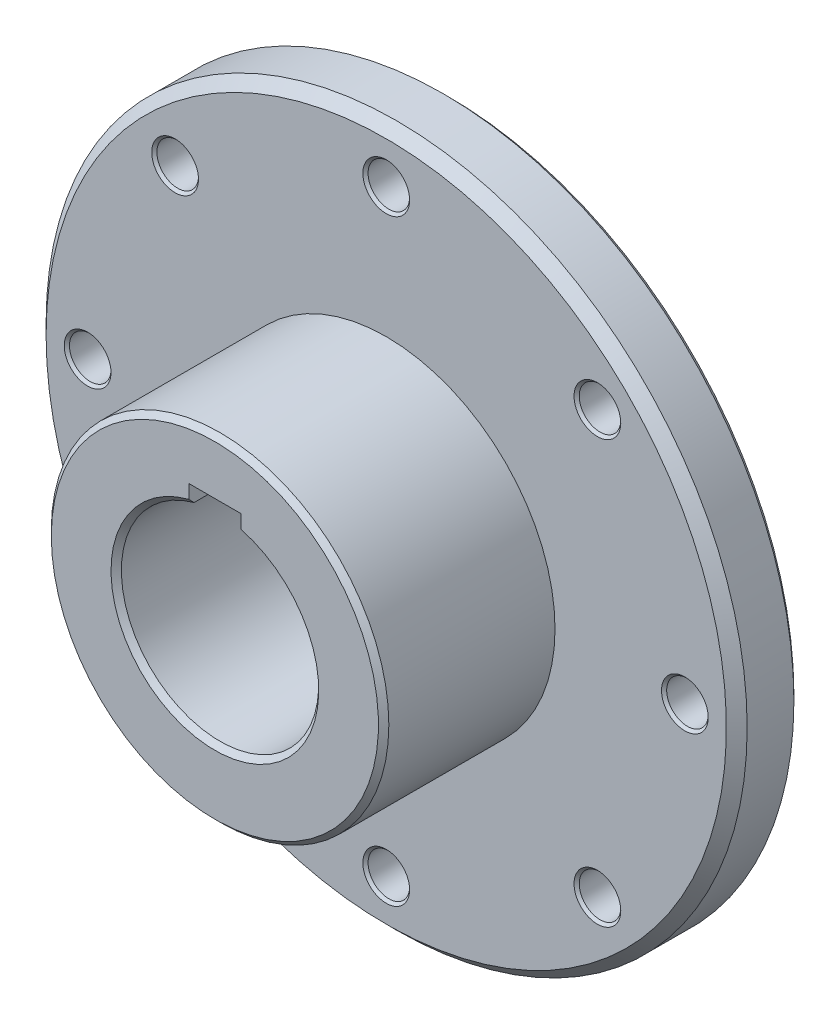
from build123d import *

# Parameters (mm, degrees)
SKETCH_1_R          = 32.5
EXTRUDE_1_DEPTH     = 10
SKETCH_2_R          = 67.5
EXTRUDE_2_DEPTH     = 12
SKETCH_3_R          = 19
CUT_EXTRUDE_1_DEPTH = 45
SKETCH_4_R          = 32.5
SKETCH_4_R_2        = 19
EXTRUDE_3_DEPTH     = 33
SKETCH_5_W          = 10
SKETCH_5_H          = 9.79155849
CUT_EXTRUDE_2_DEPTH = 111.170322683
SKETCH_6_R          = 4
CUT_EXTRUDE_3_DEPTH = 30
CHAMFER_1_SIZE      = 1
CHAMFER_2_SIZE      = 0.5
CHAMFER_3_SIZE      = 2
CHAMFER_4_SIZE      = 1


with BuildPart() as part:
    # 草图1 → 拉伸1 (new body)
    with BuildSketch(Plane.XY):
        Circle(SKETCH_1_R)
    extrude(amount=EXTRUDE_1_DEPTH)

    # 草图2 → 拉伸2 (add)
    with BuildSketch(Plane.XY.offset(10)):
        Circle(SKETCH_2_R)
    extrude(amount=EXTRUDE_2_DEPTH)

    # 草图3 → 切除-拉伸1 (cut)
    with BuildSketch(Plane.XY.offset(22)):
        Circle(SKETCH_3_R)
    extrude(amount=-CUT_EXTRUDE_1_DEPTH, mode=Mode.SUBTRACT)

    # 草图4 → 拉伸3 (add)
    with BuildSketch(Plane.XY.offset(22)):
        Circle(SKETCH_4_R)
        Circle(SKETCH_4_R_2, mode=Mode.SUBTRACT)
    extrude(amount=EXTRUDE_3_DEPTH)

    # 草图5 → 切除-拉伸2 (cut, through all)
    with BuildSketch(Plane(origin=(0, 0, 0), x_dir=(-1, 0, 0), z_dir=(0, 0, -1))):
        with Locations((0, 17.104220755)):
            Rectangle(SKETCH_5_W, SKETCH_5_H)
    extrude(amount=-CUT_EXTRUDE_2_DEPTH, mode=Mode.SUBTRACT)

    # 草图6 → 切除-拉伸3 (cut)
    with BuildSketch(Plane.XY.offset(22)):
        with Locations((40.658639918, 40.658639918)):
            Circle(SKETCH_6_R)
        with Locations((0, 57.5)):
            Circle(SKETCH_6_R)
        with Locations((57.5, 0)):
            Circle(SKETCH_6_R)
        with Locations((40.658639918, -40.658639918)):
            Circle(SKETCH_6_R)
        with Locations((0, -57.5)):
            Circle(SKETCH_6_R)
        with Locations((-40.658639918, -40.658639918)):
            Circle(SKETCH_6_R)
        with Locations((-57.5, 0)):
            Circle(SKETCH_6_R)
        with Locations((-40.658639918, 40.658639918)):
            Circle(SKETCH_6_R)
    extrude(amount=-CUT_EXTRUDE_3_DEPTH, mode=Mode.SUBTRACT)

    # 倒角1
    chamfer_1_edges = [part.edges().sort_by_distance(p)[0] for p in [
        (-32.5, 0, 55),
        (-32.5, 0, 0),
        (0, -19, 55),
        (-67.5, 0, 10),
    ]]
    chamfer(chamfer_1_edges, length=CHAMFER_1_SIZE)

    # 倒角2
    chamfer_2_edges = [part.edges().sort_by_distance(p)[0] for p in [
        (-4, 57.5, 10),
        (-4, 57.5, 22),
        (36.658639918, 40.658639918, 10),
        (36.658639918, 40.658639918, 22),
        (53.5, 0, 10),
        (53.5, 0, 22),
        (36.658639918, -40.658639918, 10),
        (36.658639918, -40.658639918, 22),
        (-4, -57.5, 10),
        (-4, -57.5, 22),
        (-44.658639918, -40.658639918, 10),
        (-44.658639918, -40.658639918, 22),
        (-61.5, 0, 10),
        (-61.5, 0, 22),
        (-44.658639918, 40.658639918, 10),
        (-44.658639918, 40.658639918, 22),
    ]]
    chamfer(chamfer_2_edges, length=CHAMFER_2_SIZE)

    # 倒角3
    chamfer_3_edges = [part.edges().sort_by_distance(p)[0] for p in [
        (-67.5, 0, 22),
    ]]
    chamfer(chamfer_3_edges, length=CHAMFER_3_SIZE)

    # 倒角4
    chamfer_4_edges = [part.edges().sort_by_distance(p)[0] for p in [
        (0, -19, 0),
    ]]
    chamfer(chamfer_4_edges, length=CHAMFER_4_SIZE)


solid = part.part
